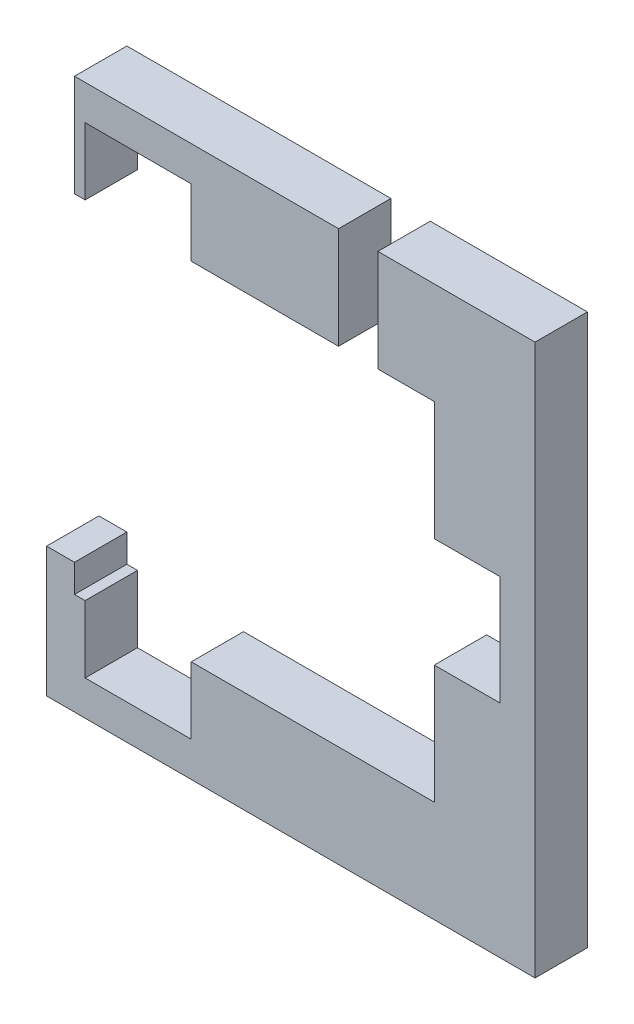
from build123d import *

# Parameters (mm, degrees)
BOSS_EXTRUDE1_DEPTH   = 4.7625
BOSS_EXTRUDE1_2_DEPTH = 4.7625


with BuildPart() as part:
    # Sketch1 → Boss-Extrude1 (new body)
    with BuildSketch(Plane.XY):
        Polygon((7547.340216607, 3420.456636514), (7547.340216607, 3429.727636514), (7571.368616607, 3429.727636514), (7571.368616607, 3420.456636514), (7557.957416607, 3420.456636514), (7557.957416607, 3426.552636514), (7548.305416607, 3426.552636514), (7548.305416607, 3420.456636514), align=None)
    extrude(amount=BOSS_EXTRUDE1_DEPTH)


with BuildPart() as body_2:
    # Sketch1 → Boss-Extrude1 2 (new body)
    with BuildSketch(Plane.XY):
        Polygon((7544.800216607, 3379.613436514), (7544.800216607, 3391.424436514), (7547.340216607, 3391.424436514), (7547.340216607, 3388.884436514), (7548.305416607, 3388.884436514), (7548.305416607, 3382.788436514), (7557.957416607, 3382.788436514), (7557.957416607, 3388.884436514), (7580.080816607, 3388.884436514), (7580.080816607, 3399.692136514), (7586.075216607, 3399.692136514), (7586.075216607, 3409.648936514), (7580.080816607, 3409.648936514), (7580.080816607, 3420.456636514), (7574.950016607, 3420.456636514), (7574.950016607, 3429.727636514), (7589.250216607, 3429.727636514), (7589.250216607, 3379.613436514), align=None)
    extrude(amount=BOSS_EXTRUDE1_2_DEPTH)


solid = Compound([part.part, body_2.part])
